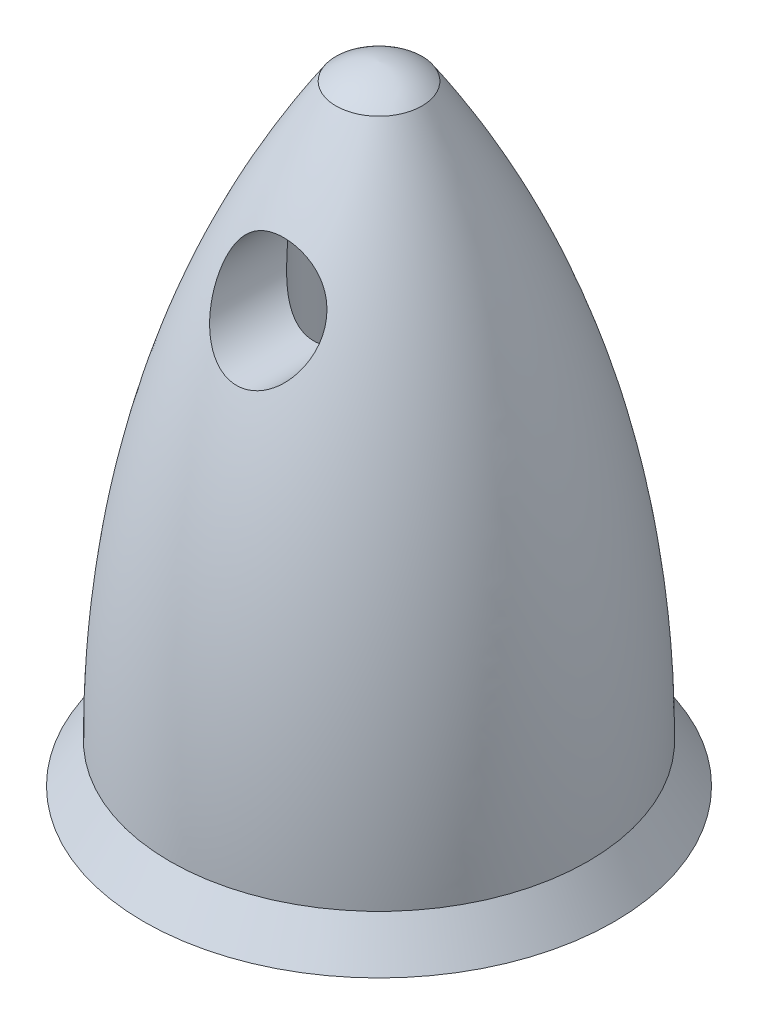
from build123d import *

# Parameters (mm, degrees)
SKETCH3_R               = 2.5
CUT_EXTRUDE1_DEPTH      = 21
CHAMFER1_SIZE           = 0.5
CUT_EXTRUDE2_DEPTH      = 28.166155503
CUT_EXTRUDE2_DEPTH_BACK = 28.166155503
SKETCH4_R               = 2


with BuildPart() as part:
    # Sketch2 → Revolve1 (revolve)
    with BuildSketch(Plane.XY, mode=Mode.PRIVATE) as revolve1_sk:
        with BuildLine():
            add(Edge.make_bspline(
                [(8, 1.5), (8.005098379, 13.819525591), (1.647422345, 23.362221291)],
                knots=[0, 0, 0, 1, 1, 1], degree=2))
            add(Edge.make_bspline(
                [(1.647422345, 23.362221291), (0.928333001, 23.940015195), (0, 24)],
                knots=[0, 0, 0, 1, 1, 1], degree=2))
            Line((0, 24), (0, 1.5))
            Line((0, 1.5), (8, 1.5))
        make_face()
        Polygon((0, 0), (0, 1.5), (8, 1.5), (9, 0), align=None)
    revolve(revolve1_sk.sketch.rotate(Axis((0, 0, 0), (0, 1, 0)), 90), axis=Axis((0, 0, 0), (0, 1, 0)))

    # Sketch3 → Cut-Extrude1 (cut)
    with BuildSketch(Plane.XZ):
        with Locations(Location((0, 0, 0), (0, 0, 270))):
            Circle(SKETCH3_R)
    extrude(amount=-CUT_EXTRUDE1_DEPTH, mode=Mode.SUBTRACT)

    # Chamfer1
    chamfer1_edges = [part.edges().sort_by_distance(p)[0] for p in [
        (0, 0, 2.5),
    ]]
    chamfer(chamfer1_edges, length=CHAMFER1_SIZE)

    # Sketch4 → Cut-Extrude2 (cut, two sides: drawn at the far end of the back side and taken through both)
    with BuildSketch(Plane.XY.offset(-CUT_EXTRUDE2_DEPTH_BACK)):
        with Locations((0, 18)):
            Circle(SKETCH4_R)
    extrude(amount=CUT_EXTRUDE2_DEPTH + CUT_EXTRUDE2_DEPTH_BACK, mode=Mode.SUBTRACT)


solid = part.part
